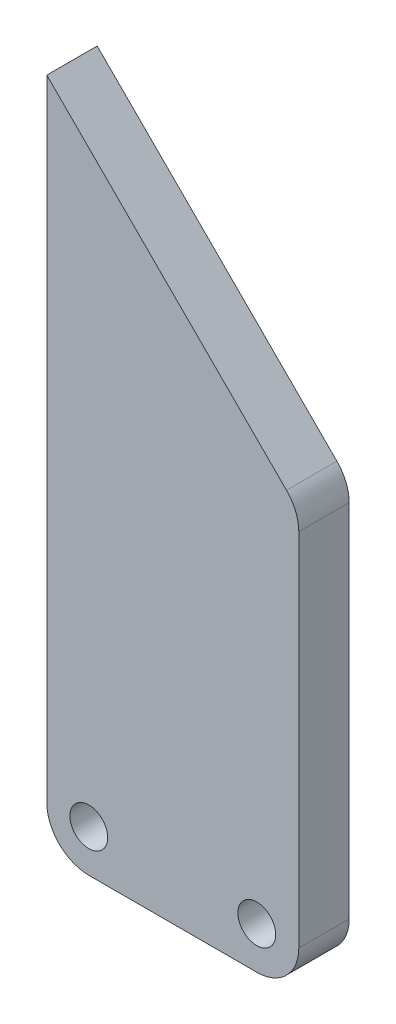
from build123d import *

# Parameters (mm, degrees)
SALIENTE_EXTRUIR1_DEPTH      = 3
TALADRO_DE_MARGEN_PARA_M41_D = 4.5
REDONDEO1_R                  = 5


with BuildPart() as part:
    # Croquis1 → Saliente-Extruir1 (new, symmetric)
    with BuildSketch(Plane.XY):
        Polygon((0, 0), (0, 80), (30, 50), (30, 0), align=None)
    extrude(amount=SALIENTE_EXTRUIR1_DEPTH, both=True)

    # Taladro de margen para M41 (through all)
    with Locations(Plane.XY.offset(3)):
        with Locations((5, 5), (25, 5)):
            Hole(TALADRO_DE_MARGEN_PARA_M41_D / 2)

    # Redondeo1
    redondeo1_edges = [part.edges().sort_by_distance(p)[0] for p in [
        (0, 0, 0),
        (30, 50, 0),
        (30, 0, 0),
    ]]
    fillet(redondeo1_edges, radius=REDONDEO1_R)


solid = part.part
